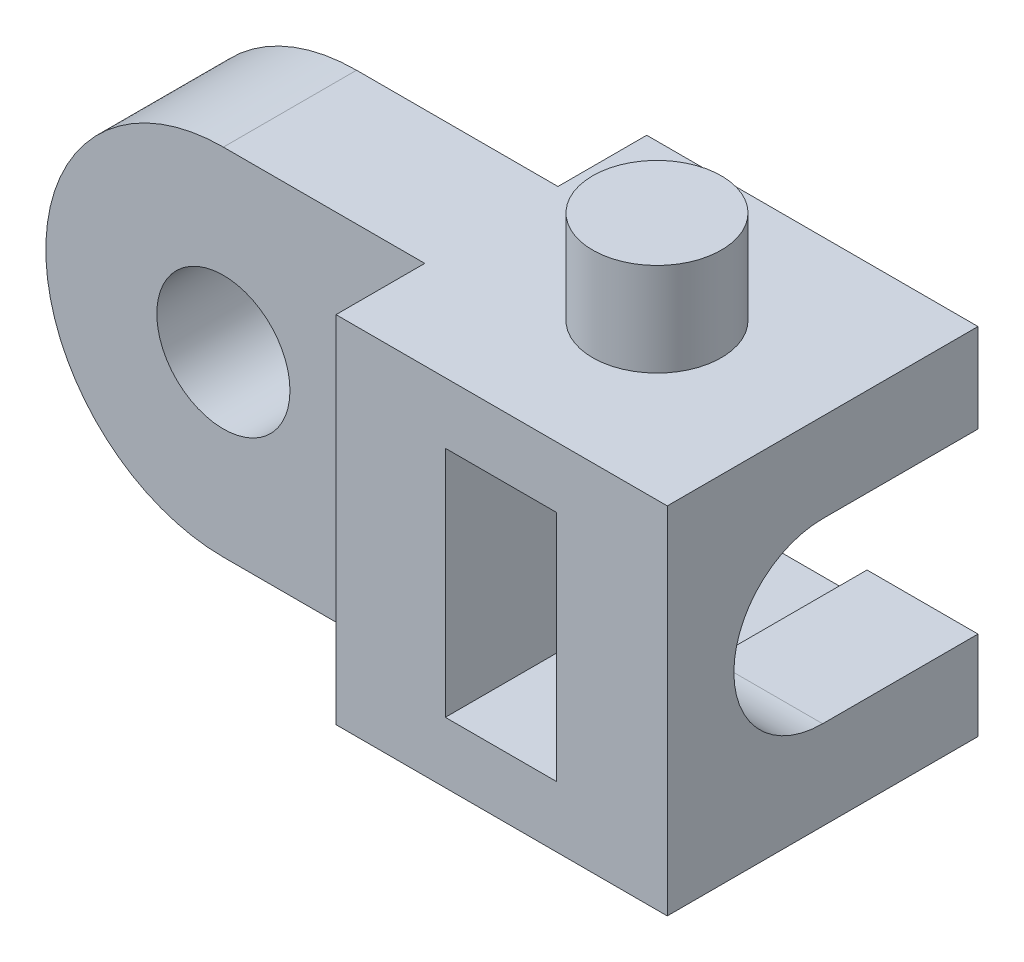
from build123d import *

# Parameters (mm, degrees)
SKETCH1_R               = 1.5
BOSS_EXTRUDE1_DEPTH     = 1.5
SKETCH5_W               = 7.463090523
SKETCH5_H               = 8
BOSS_EXTRUDE2_DEPTH     = 3.5
CUT_EXTRUDE1_DEPTH      = 7
CUT_EXTRUDE1_DEPTH_BACK = 6
SKETCH2_W               = 2.5
SKETCH2_H               = 5.25
SKETCH3_R               = 2
CUT_EXTRUDE2_DEPTH      = 3
SKETCH6_W               = 5
SKETCH6_H               = 4
CUT_EXTRUDE3_DEPTH      = 3.5
SKETCH7_R               = 1.45
BOSS_EXTRUDE3_DEPTH     = 2.1


with BuildPart() as part:
    # Sketch1 → Boss-Extrude1 (new, symmetric)
    with BuildSketch(Plane.XY):
        with BuildLine():
            Line((12, 4), (0, 4))
            ThreePointArc((0, 4), (-4, 0), (0, -4))
            Line((0, -4), (12, -4))
            Line((12, -4), (12, 4))
        make_face()
        Circle(SKETCH1_R, mode=Mode.SUBTRACT)
    extrude(amount=BOSS_EXTRUDE1_DEPTH, both=True)

    # Sketch5 → Boss-Extrude2 (add, symmetric)
    with BuildSketch(Plane.XY):
        with Locations((8.268454739, 0)):
            Rectangle(SKETCH5_W, SKETCH5_H)
    extrude(amount=BOSS_EXTRUDE2_DEPTH, both=True)

    # Sketch2 → Cut-Extrude1 (cut, two sides: drawn at the far end of the back side and taken through both)
    with BuildSketch(Plane.XY.offset(1.5).offset(-CUT_EXTRUDE1_DEPTH_BACK)):
        with Locations((8.25, 0)):
            Rectangle(SKETCH2_W, SKETCH2_H)
    extrude(amount=CUT_EXTRUDE1_DEPTH + CUT_EXTRUDE1_DEPTH_BACK, mode=Mode.SUBTRACT)

    # Sketch3 → Cut-Extrude2 (cut)
    with BuildSketch(Plane(origin=(12, 0, 0), x_dir=(0, 0, -1), z_dir=(1, 0, 0))):
        with Locations(Location((0, 0, 0), (0, 0, 90))):
            Circle(SKETCH3_R)
    extrude(amount=-CUT_EXTRUDE2_DEPTH, mode=Mode.SUBTRACT)

    # Sketch6 → Cut-Extrude3 (cut)
    with BuildSketch(Plane(origin=(0, 0, -3.5), x_dir=(-1, 0, 0), z_dir=(0, 0, -1))):
        with Locations((-12, 0)):
            Rectangle(SKETCH6_W, SKETCH6_H)
    extrude(amount=-CUT_EXTRUDE3_DEPTH, mode=Mode.SUBTRACT)

    # Sketch7 → Boss-Extrude3 (add)
    with BuildSketch(Plane(origin=(0, 4, 0), x_dir=(1, 0, 0), z_dir=(0, 1, 0))):
        with Locations(Location((8.268454739, 0, 0), (0, 0, 180))):
            Circle(SKETCH7_R)
    extrude(amount=BOSS_EXTRUDE3_DEPTH)


solid = part.part
